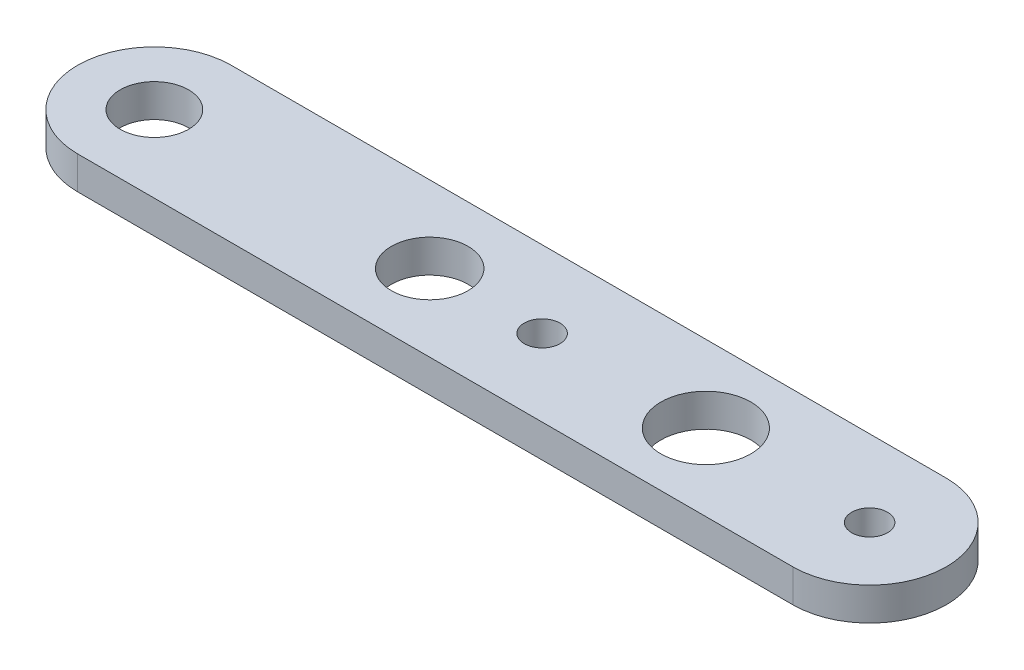
from build123d import *

# Parameters (mm, degrees)
SKETCH1_R           = 3.9624
SKETCH1_R_2         = 2.0701
SKETCH1_R_3         = 5.207
SKETCH1_R_4         = 4.445
BOSS_EXTRUDE1_DEPTH = 3.81


with BuildPart() as part:
    # Sketch1 → Boss-Extrude1 (new body)
    with BuildSketch(Plane(origin=(0, 0, 0), x_dir=(1, 0, 0), z_dir=(0, 1, 0))):
        with BuildLine():
            Line((0, 8.89), (82.8167, 8.89))
            ThreePointArc((82.8167, 8.89), (91.7067, 0), (82.8167, -8.89))
            Line((82.8167, -8.89), (0, -8.89))
            ThreePointArc((0, -8.89), (-8.89, 0), (0, 8.89))
        make_face()
        with Locations(Location((0, 0, 0), (0, 0, 90))):
            Circle(SKETCH1_R, mode=Mode.SUBTRACT)
        with Locations(Location((82.8167, 0, 0), (0, 0, 90))):
            Circle(SKETCH1_R_2, mode=Mode.SUBTRACT)
        with Locations(Location((44.8945, 0, 0), (0, 0, 90))):
            Circle(SKETCH1_R_2, mode=Mode.SUBTRACT)
        with Locations(Location((63.8556, 0, 0), (0, 0, 90))):
            Circle(SKETCH1_R_3, mode=Mode.SUBTRACT)
        with Locations(Location((31.877, 0, 0), (0, 0, 90))):
            Circle(SKETCH1_R_4, mode=Mode.SUBTRACT)
    extrude(amount=BOSS_EXTRUDE1_DEPTH)


solid = part.part
